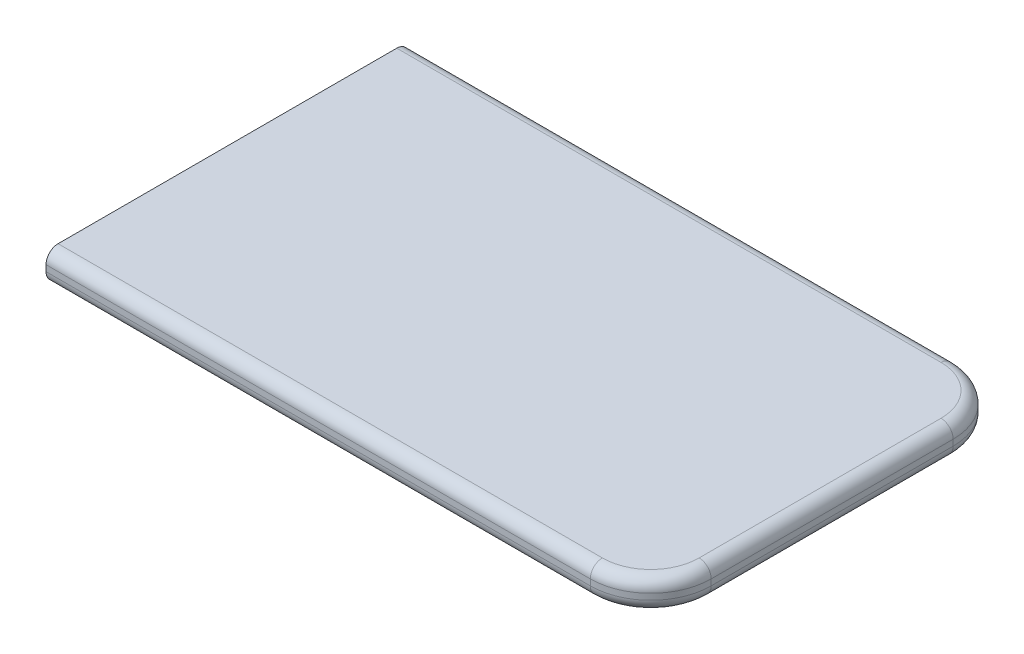
from build123d import *

# Parameters (mm, degrees)
SKETCH1_W           = 1000
SKETCH1_H           = 600
BOSS_EXTRUDE1_DEPTH = 50
FILLET1_R           = 100
FILLET2_R           = 20


with BuildPart() as part:
    # Sketch1 → Boss-Extrude1 (new body)
    with BuildSketch(Plane(origin=(0, 0, 0), x_dir=(1, 0, 0), z_dir=(0, 1, 0))):
        with Locations((-500, 300)):
            Rectangle(SKETCH1_W, SKETCH1_H)
    extrude(amount=BOSS_EXTRUDE1_DEPTH)

    # Fillet1
    fillet1_edges = [part.edges().sort_by_distance(p)[0] for p in [
        (0, 25, 0),
        (0, 25, -600),
    ]]
    fillet(fillet1_edges, radius=FILLET1_R)

    # Fillet2
    fillet2_edges = [part.edges().sort_by_distance(p)[0] for p in [
        (-550, 0, -600),
        (-550, 50, -600),
        (0, 0, -300),
        (-550, 0, 0),
        (-29.289321881, 0, -29.289321881),
        (-29.289321881, 0, -570.710678119),
        (0, 50, -300),
        (-550, 50, 0),
        (-29.289321881, 50, -29.289321881),
        (-29.289321881, 50, -570.710678119),
    ]]
    fillet(fillet2_edges, radius=FILLET2_R)


solid = part.part
